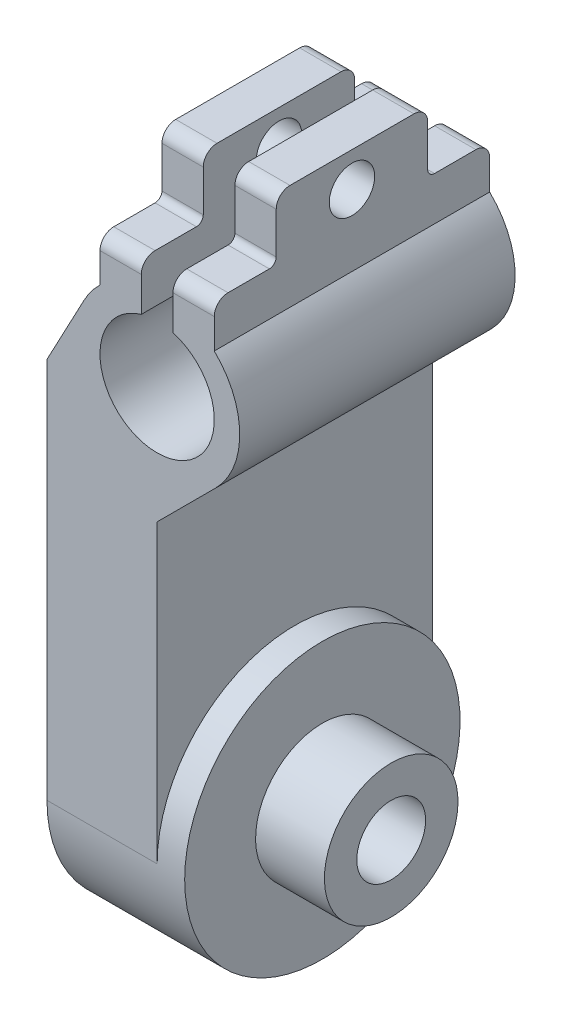
from build123d import *

# Parameters (mm, degrees)
EXTRUDE_1_DEPTH             = 10
SKETCH_6_R                  = 1.65
SKETCH_6_W                  = 14.704506527
SKETCH_6_H                  = 8.520368268
CUT_EXTRUDE_2_DEPTH         = 34.876577454
FILLET_1_R                  = 1
FILLET_2_R                  = 0.5
EXTRUDE_2_REACH             = 34.619
SKETCH_7_R                  = 10
EXTRUDE_2_DIRECTION_2_DEPTH = 2
SKETCH_8_R                  = 4.85
EXTRUDE_3_DEPTH             = 5
SKETCH_9_R                  = 2.5
CUT_EXTRUDE_3_DEPTH         = 44.874821937


with BuildPart() as part:
    # 草图1 → 凸台-拉伸1 (new, symmetric)
    with BuildSketch(Plane.XY):
        with BuildLine():
            Line((-1.15, 3.987480407), (-1.15, 12))
            Line((-1.15, 12), (-4.15, 12))
            Line((-4.15, 12), (-4.15, 4.333301282))
            ThreePointArc((-4.15, 4.333301282), (-4.784308974, 3.620826928), (-5.297685557, 2.816829377))
            Line((-5.297685557, 2.816829377), (-8, -2.265484914))
            Line((-8, -2.265484914), (-8, -30))
            Line((-8, -30), (0, -30))
            Line((0, -30), (0, -8.485281374))
            Line((0, -8.485281374), (4.242640687, -4.242640687))
            ThreePointArc((4.242640687, -4.242640687), (5.999649956, 0.064810571), (4.15, 4.333301282))
            Line((4.15, 4.333301282), (4.15, 12))
            Line((4.15, 12), (1.15, 12))
            Line((1.15, 12), (1.15, 3.987480407))
            ThreePointArc((1.15, 3.987480407), (0, -4.15), (-1.15, 3.987480407))
        make_face()
    extrude(amount=EXTRUDE_1_DEPTH, both=True)

    # 草图6 → 切除-拉伸2 (cut, through all)
    with BuildSketch(Plane(origin=(4.15, 0, 0), x_dir=(0, 0, -1), z_dir=(1, 0, 0))):
        with Locations(Location((0, 9.5, 0), (0, 0, 90))):
            Circle(SKETCH_6_R)
        with Locations((-12.852253263, 11.760184134)):
            Rectangle(SKETCH_6_W, SKETCH_6_H)
        with Locations((12.852253263, 11.760184134)):
            Rectangle(SKETCH_6_W, SKETCH_6_H)
    extrude(amount=-CUT_EXTRUDE_2_DEPTH, mode=Mode.SUBTRACT)

    # 圆角1
    fillet_1_edges = [part.edges().sort_by_distance(p)[0] for p in [
        (2.65, 7.5, -10),
        (-2.65, 7.5, -10),
        (2.65, 7.5, 10),
        (-2.65, 7.5, 10),
        (2.65, 12, 5.5),
        (-2.65, 12, 5.5),
        (2.65, 12, -5.5),
        (-2.65, 12, -5.5),
    ]]
    fillet(fillet_1_edges, radius=FILLET_1_R)

    # 圆角2
    fillet_2_edges = [part.edges().sort_by_distance(p)[0] for p in [
        (-2.65, 7.5, 5.5),
        (2.65, 7.5, 5.5),
        (2.65, 7.5, -5.5),
        (-2.65, 7.5, -5.5),
    ]]
    fillet(fillet_2_edges, radius=FILLET_2_R)

    # 凸台-拉伸2: up to this face of the body (flat: up to its plane)
    extrude_2_end = Plane(part.part.faces().sort_by_distance((-8, -16.132742457, 0))[0])
    # 草图7 → 凸台-拉伸2 (add, up to the picked face)
    with BuildSketch(Plane(origin=(0, 0, 0), x_dir=(0, 0, -1), z_dir=(1, 0, 0)), mode=Mode.PRIVATE) as extrude_2_sk1:
        with Locations(Location((0, -30, 0), (0, 0, 180))):
            Circle(SKETCH_7_R)
    extrude_2_tool1 = split(extrude(extrude_2_sk1.sketch, amount=-EXTRUDE_2_REACH, mode=Mode.PRIVATE), bisect_by=extrude_2_end, keep=Keep.BOTH, mode=Mode.PRIVATE)
    add(extrude_2_tool1.solids().sort_by(Axis((0, -30, 0), (-1, 0, 0)))[0])

    # 草图7 → 凸台-拉伸2 direction 2 (add)
    with BuildSketch(Plane(origin=(0, 0, 0), x_dir=(0, 0, -1), z_dir=(1, 0, 0))):
        with Locations(Location((0, -30, 0), (0, 0, 180))):
            Circle(SKETCH_7_R)
    extrude(amount=EXTRUDE_2_DIRECTION_2_DEPTH)

    # 草图8 → 凸台-拉伸3 (add)
    with BuildSketch(Plane(origin=(2, 0, 0), x_dir=(0, 0, -1), z_dir=(1, 0, 0))):
        with Locations(Location((0, -30, 0), (0, 0, 90))):
            Circle(SKETCH_8_R)
    extrude(amount=EXTRUDE_3_DEPTH)

    # 草图9 → 切除-拉伸3 (cut, through all)
    with BuildSketch(Plane(origin=(7, 0, 0), x_dir=(0, 0, -1), z_dir=(1, 0, 0))):
        with Locations(Location((0, -30, 0), (0, 0, 90))):
            Circle(SKETCH_9_R)
    extrude(amount=-CUT_EXTRUDE_3_DEPTH, mode=Mode.SUBTRACT)


solid = part.part
